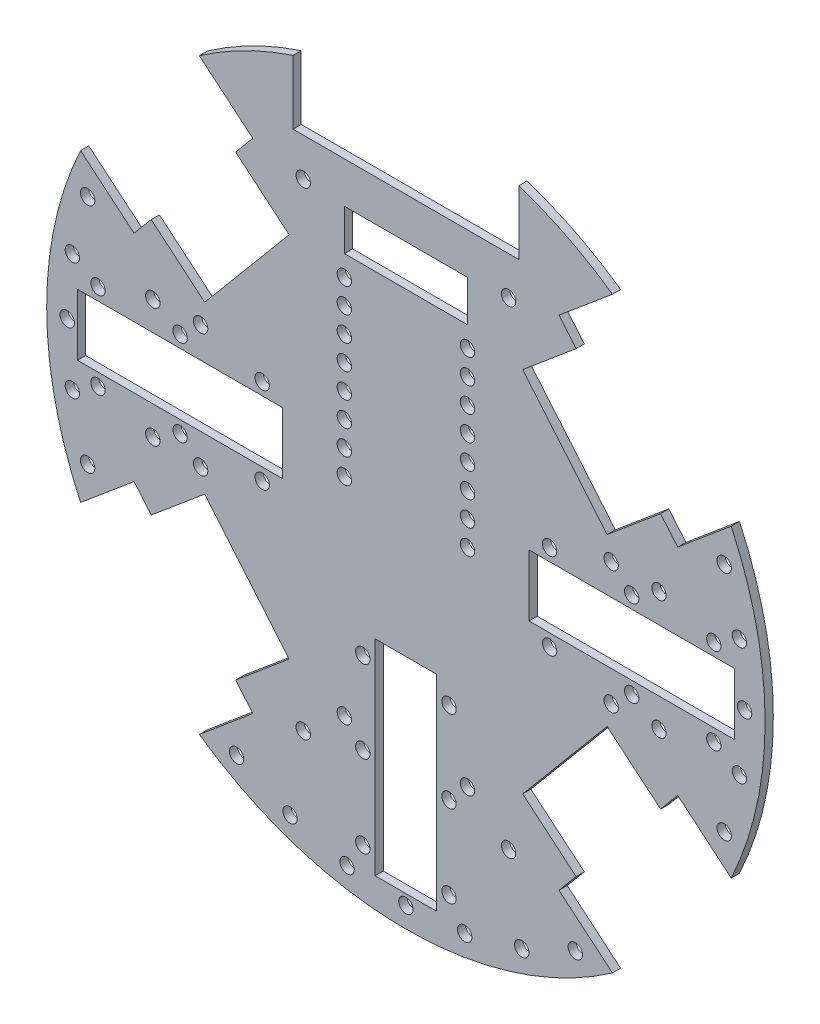
from build123d import *

# Parameters (mm, degrees)
SKETCH1_R                                  = 87.5
BOSS_EXTRUDE1_DEPTH                        = 2
SKETCH3_R                                  = 1.75
CUT_EXTRUDE1_DEPTH                         = 124.759848093
MIRROR1_AT_THE_SECOND_PLANE_COPY_1_SKETC_R = 1.75
MIRROR1_AT_THE_SECOND_PLANE_COPY_1_DEPTH   = 124.759848093
CUT_EXTRUDE2_DEPTH                         = 124.759848093
CUT_EXTRUDE2_DEPTH_BACK                    = 124.759848093
SKETCH4_W                                  = 55
SKETCH4_H                                  = 40
SKETCH5_R                                  = 1.75
CUT_EXTRUDE3_DEPTH                         = 124.759848093
SKETCH8_W                                  = 50
SKETCH8_H                                  = 15
CUT_EXTRUDE4_DEPTH                         = 124.759848093
SKETCH9_R                                  = 1.75
CUT_EXTRUDE5_DEPTH                         = 124.759848093
CIRPATTERN1_COUNT                          = 3
CIRPATTERN1_ANGLE                          = 180
SKETCH10_W                                 = 30
SKETCH10_H                                 = 10
CUT_EXTRUDE6_DEPTH                         = 124.759848093
SKETCH11_R                                 = 1.75
CUT_EXTRUDE7_DEPTH                         = 124.759848093
SKETCH12_R                                 = 1.75
CUT_EXTRUDE8_DEPTH                         = 124.759848093
SKETCH13_R                                 = 1.75
CUT_EXTRUDE9_DEPTH                         = 124.759848093


with BuildPart() as part:
    # Sketch1 → Boss-Extrude1 (new body)
    with BuildSketch(Plane.XY):
        Circle(SKETCH1_R)
    extrude(amount=-BOSS_EXTRUDE1_DEPTH)

    # Sketch3 → Cut-Extrude1 (cut, through all)
    with BuildSketch(Plane.XY):
        with BuildLine():
            Line((-62.036781461, 31.168523814), (-49.014025927, 20.241134449))
            Line((-49.014025927, 20.241134449), (-28.444822418, 44.754556629))
            Line((-28.444822418, 44.754556629), (-41.467577951, 55.681945993))
            Line((-41.467577951, 55.681945993), (-37.289458488, 60.661234874))
            Line((-37.289458488, 60.661234874), (-50.312214021, 71.588624238))
            ThreePointArc((-50.312214021, 71.588624238), (-67.028888773, 56.243915848), (-79.237656457, 37.116624298))
            Line((-79.237656457, 37.116624298), (-66.214900923, 26.189234933))
            Line((-66.214900923, 26.189234933), (-62.036781461, 31.168523814))
        make_face()
        with Locations((-61.645137707, 14.522304568)):
            Circle(SKETCH3_R)
        with Locations((-25.006243955, 58.186837826)):
            Circle(SKETCH3_R)
    cut_extrude1 = extrude(amount=-CUT_EXTRUDE1_DEPTH, mode=Mode.SUBTRACT)

    # Mirror1: Cut-Extrude1 across plane
    add(cut_extrude1.mirror(Plane(origin=(0, 0, 0), x_dir=(0, 0, 1), z_dir=(1, 0, 0))), mode=Mode.SUBTRACT)

    # Mirror1 at the second plane: Cut-Extrude1 across plane
    add(cut_extrude1.mirror(Plane.ZX), mode=Mode.SUBTRACT)

    # Mirror1 at the second plane copy 1 sketc → Mirror1 at the second plane copy 1 (cut, through all)
    with BuildSketch(Plane(origin=(0, 0, 0), x_dir=(-1, 0, 0), z_dir=(0, 0, 1))):
        with BuildLine():
            Line((-62.036781461, 31.168523814), (-49.014025927, 20.241134449))
            Line((-49.014025927, 20.241134449), (-28.444822418, 44.754556629))
            Line((-28.444822418, 44.754556629), (-41.467577951, 55.681945993))
            Line((-41.467577951, 55.681945993), (-37.289458488, 60.661234874))
            Line((-37.289458488, 60.661234874), (-50.312214021, 71.588624238))
            ThreePointArc((-50.312214021, 71.588624238), (-67.028888773, 56.243915848), (-79.237656457, 37.116624298))
            Line((-79.237656457, 37.116624298), (-66.214900923, 26.189234933))
            Line((-66.214900923, 26.189234933), (-62.036781461, 31.168523814))
        make_face()
        with Locations((-61.645137707, 14.522304568)):
            Circle(MIRROR1_AT_THE_SECOND_PLANE_COPY_1_SKETC_R)
        with Locations((-25.006243955, 58.186837826)):
            Circle(MIRROR1_AT_THE_SECOND_PLANE_COPY_1_SKETC_R)
    extrude(amount=-MIRROR1_AT_THE_SECOND_PLANE_COPY_1_DEPTH, mode=Mode.SUBTRACT)

    # Sketch4 → Cut-Extrude2 (cut, two sides: drawn at the far end of the back side and taken through both)
    with BuildSketch(Plane.XY.offset(-CUT_EXTRUDE2_DEPTH_BACK)):
        with Locations((0, 87.5)):
            Rectangle(SKETCH4_W, SKETCH4_H)
    extrude(amount=CUT_EXTRUDE2_DEPTH + CUT_EXTRUDE2_DEPTH_BACK, mode=Mode.SUBTRACT)

    # Sketch5 → Cut-Extrude3 (cut, through all)
    with BuildSketch(Plane.XY):
        with Locations((-50, 15)):
            Circle(SKETCH5_R)
        with Locations((-50, -15)):
            Circle(SKETCH5_R)
    cut_extrude3 = extrude(amount=-CUT_EXTRUDE3_DEPTH, mode=Mode.SUBTRACT)

    # Sketch8 → Cut-Extrude4 (cut, through all)
    with BuildSketch(Plane.XY):
        with Locations((-55, 0)):
            Rectangle(SKETCH8_W, SKETCH8_H)
    cut_extrude4 = extrude(amount=-CUT_EXTRUDE4_DEPTH, mode=Mode.SUBTRACT)

    # Sketch9 → Cut-Extrude5 (cut, through all)
    with BuildSketch(Plane.XY):
        with Locations((-35, 10.5)):
            Circle(SKETCH9_R)
        with Locations((-35, -10.5)):
            Circle(SKETCH9_R)
        with Locations((-55, 10.5)):
            Circle(SKETCH9_R)
        with Locations((-55, -10.5)):
            Circle(SKETCH9_R)
        with Locations((-75, 10.5)):
            Circle(SKETCH9_R)
        with Locations((-75, -10.5)):
            Circle(SKETCH9_R)
    cut_extrude5 = extrude(amount=-CUT_EXTRUDE5_DEPTH, mode=Mode.SUBTRACT)

    # CirPattern1: Cut-Extrude3, Cut-Extrude4, Cut-Extrude5 ×3 about axis
    cirpattern1_axis = Axis((0, 0, 0), (0, 0, 1))
    add([cut_extrude3.rotate(cirpattern1_axis, i * CIRPATTERN1_ANGLE / (CIRPATTERN1_COUNT - 1)) for i in range(1, CIRPATTERN1_COUNT)], mode=Mode.SUBTRACT)
    add([cut_extrude4.rotate(cirpattern1_axis, i * CIRPATTERN1_ANGLE / (CIRPATTERN1_COUNT - 1)) for i in range(1, CIRPATTERN1_COUNT)], mode=Mode.SUBTRACT)
    add([cut_extrude5.rotate(cirpattern1_axis, i * CIRPATTERN1_ANGLE / (CIRPATTERN1_COUNT - 1)) for i in range(1, CIRPATTERN1_COUNT)], mode=Mode.SUBTRACT)

    # Sketch10 → Cut-Extrude6 (cut, through all)
    with BuildSketch(Plane.XY):
        with Locations((0, 52.5)):
            Rectangle(SKETCH10_W, SKETCH10_H)
    extrude(amount=-CUT_EXTRUDE6_DEPTH, mode=Mode.SUBTRACT)

    # Sketch11 → Cut-Extrude7 (cut, through all)
    with BuildSketch(Plane.XY):
        with Locations((-15, 42.5)):
            Circle(SKETCH11_R)
        with Locations((15, 42.5)):
            Circle(SKETCH11_R)
        with Locations((-15, 36.5)):
            Circle(SKETCH11_R)
        with Locations((15, 36.5)):
            Circle(SKETCH11_R)
        with Locations((-15, 30.5)):
            Circle(SKETCH11_R)
        with Locations((15, 30.5)):
            Circle(SKETCH11_R)
        with Locations((-15, 24.5)):
            Circle(SKETCH11_R)
        with Locations((15, 24.5)):
            Circle(SKETCH11_R)
        with Locations((-15, 18.5)):
            Circle(SKETCH11_R)
        with Locations((15, 18.5)):
            Circle(SKETCH11_R)
        with Locations((-15, 12.5)):
            Circle(SKETCH11_R)
        with Locations((15, 12.5)):
            Circle(SKETCH11_R)
        with Locations((-15, 6.5)):
            Circle(SKETCH11_R)
        with Locations((15, 6.5)):
            Circle(SKETCH11_R)
        with Locations((-15, 0.5)):
            Circle(SKETCH11_R)
        with Locations((15, 0.5)):
            Circle(SKETCH11_R)
    extrude(amount=-CUT_EXTRUDE7_DEPTH, mode=Mode.SUBTRACT)

    # Sketch12 → Cut-Extrude8 (cut, through all)
    with BuildSketch(Plane.XY):
        with Locations((-77.524641215, 28.216661824)):
            Circle(SKETCH12_R)
        with Locations((-81.246639624, 14.325974658)):
            Circle(SKETCH12_R)
        with Locations((-82.5, 0)):
            Circle(SKETCH12_R)
        with Locations((-81.246639624, -14.325974658)):
            Circle(SKETCH12_R)
        with Locations((-77.524641215, -28.216661824)):
            Circle(SKETCH12_R)
    cut_extrude8 = extrude(amount=-CUT_EXTRUDE8_DEPTH, mode=Mode.SUBTRACT)

    # Mirror2: Cut-Extrude8 across plane
    add(cut_extrude8.mirror(Plane(origin=(0, 0, 0), x_dir=(0, 0, 1), z_dir=(1, 0, 0))), mode=Mode.SUBTRACT)

    # Sketch13 → Cut-Extrude9 (cut, through all)
    with BuildSketch(Plane.XY):
        with Locations((-41.25, -71.447095812)):
            Circle(SKETCH13_R)
        with Locations((-28.216661824, -77.524641215)):
            Circle(SKETCH13_R)
        with Locations((-14.325974658, -81.246639624)):
            Circle(SKETCH13_R)
        with Locations((0, -82.5)):
            Circle(SKETCH13_R)
        with Locations((14.325974658, -81.246639624)):
            Circle(SKETCH13_R)
        with Locations((28.216661824, -77.524641215)):
            Circle(SKETCH13_R)
        with Locations((41.25, -71.447095812)):
            Circle(SKETCH13_R)
    extrude(amount=-CUT_EXTRUDE9_DEPTH, mode=Mode.SUBTRACT)


solid = part.part
